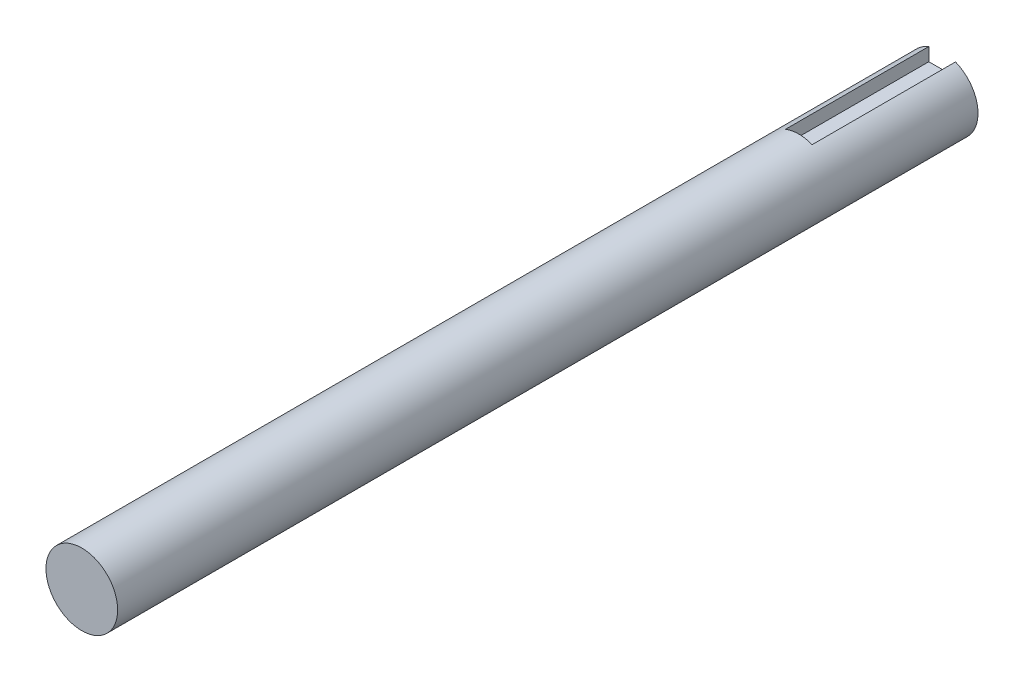
from build123d import *

# Parameters (mm, degrees)
BOSS_EXTRUDE1_DEPTH      = 38.1
BOSS_EXTRUDE1_DEPTH_BACK = 38.1
SKETCH2_R                = 3.175
CUT_EXTRUDE1_DEPTH       = 12.7


with BuildPart() as part:
    # Sketch2 → Boss-Extrude1 (new, two sides: drawn at the far end of the back side and taken through both)
    with BuildSketch(Plane.XY.offset(-BOSS_EXTRUDE1_DEPTH_BACK)):
        with Locations(Location((0, 0, 0), (0, 0, 180))):
            Circle(SKETCH2_R)
    extrude(amount=BOSS_EXTRUDE1_DEPTH + BOSS_EXTRUDE1_DEPTH_BACK)

    # Sketch3 → Cut-Extrude1 (cut)
    with BuildSketch(Plane(origin=(0, 0, -38.1), x_dir=(-1, 0, 0), z_dir=(0, 0, -1))):
        with BuildLine():
            Line((1.1811, 2.947138916), (1.1811, 1.778738916))
            Line((1.1811, 1.778738916), (-1.1811, 1.778738916))
            Line((-1.1811, 1.778738916), (-1.1811, 2.947138916))
            ThreePointArc((-1.1811, 2.947138916), (0, 3.175), (1.1811, 2.947138916))
        make_face()
    extrude(amount=-CUT_EXTRUDE1_DEPTH, mode=Mode.SUBTRACT)


solid = part.part
